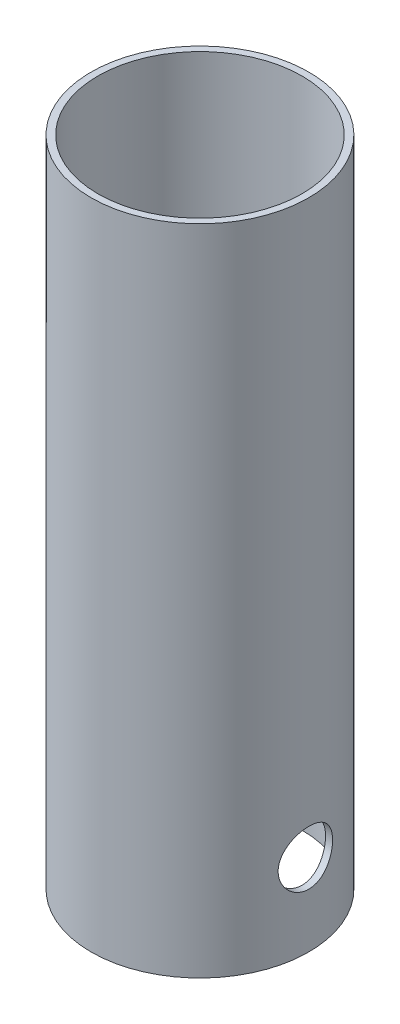
from build123d import *

# Parameters (mm, degrees)
SKETCH1_R           = 50.8
SKETCH1_R_2         = 47.625
BOSS_EXTRUDE1_DEPTH = 304.8
SKETCH2_R           = 12.7
CUT_EXTRUDE1_DEPTH  = 314.152231351


with BuildPart() as part:
    # Sketch1 → Boss-Extrude1 (new body)
    with BuildSketch(Plane(origin=(0, 0, 0), x_dir=(1, 0, 0), z_dir=(0, 1, 0))):
        with Locations(Location((0, 0, 0), (0, 0, 90))):
            Circle(SKETCH1_R)
        with Locations(Location((0, 0, 0), (0, 0, 90))):
            Circle(SKETCH1_R_2, mode=Mode.SUBTRACT)
    extrude(amount=BOSS_EXTRUDE1_DEPTH)

    # Sketch2 → Cut-Extrude1 (cut, through all)
    with BuildSketch(Plane(origin=(0, 0, 0), x_dir=(0, 0, -1), z_dir=(1, 0, 0))):
        with Locations(Location((0, 38.1, 0), (0, 0, 180))):
            Circle(SKETCH2_R)
    extrude(amount=CUT_EXTRUDE1_DEPTH, mode=Mode.SUBTRACT)


solid = part.part
